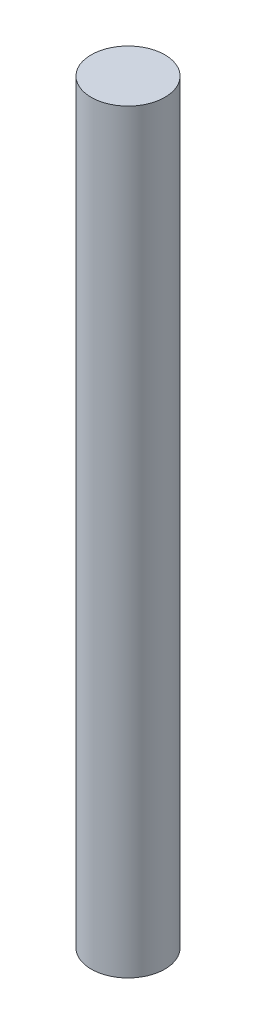
from build123d import *

# Parameters (mm, degrees)
SKETCH_1_R      = 10
EXTRUDE_1_DEPTH = 205


with BuildPart() as part:
    # Эскиз1 → Бобышка-Вытянуть1 (new body)
    with BuildSketch(Plane(origin=(0, 0, 0), x_dir=(1, 0, 0), z_dir=(0, 1, 0))):
        with Locations(Location((0, 0, 0), (0, 0, 90))):
            Circle(SKETCH_1_R)
    extrude(amount=EXTRUDE_1_DEPTH)


solid = part.part
